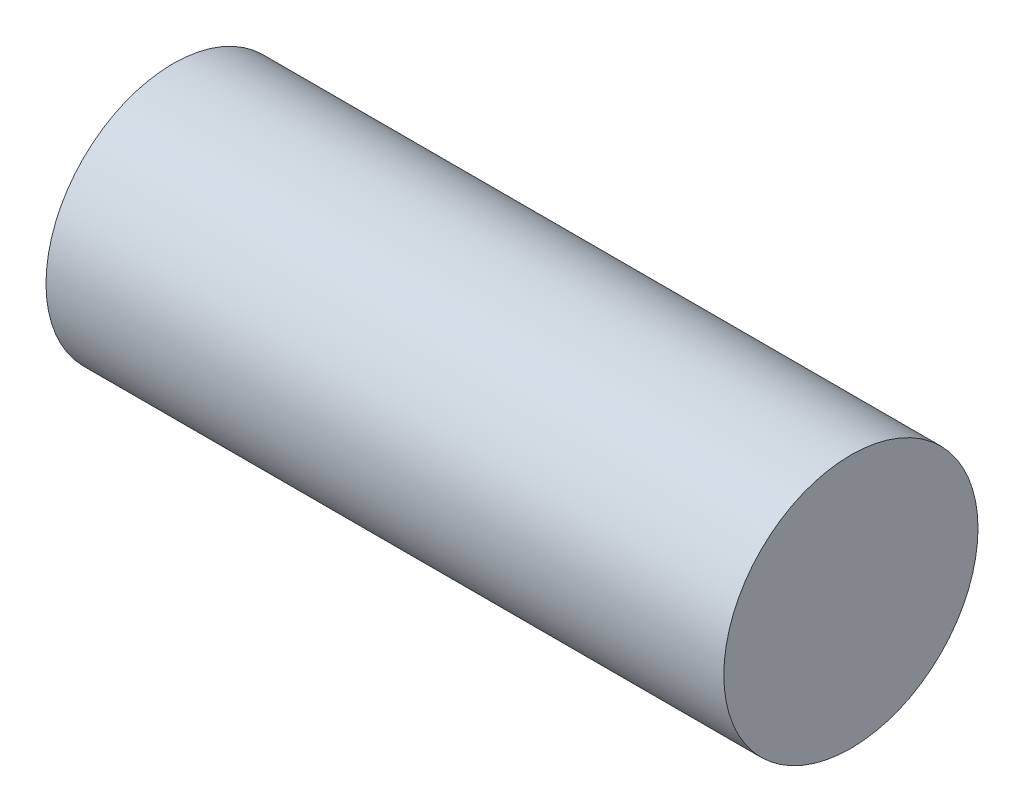
from build123d import *

# Parameters (mm, degrees)
SKETCH1_R           = 38.1
BOSS_EXTRUDE1_DEPTH = 101.6


with BuildPart() as part:
    # Sketch1 → Boss-Extrude1 (new, symmetric)
    with BuildSketch(Plane(origin=(0, 0, 0), x_dir=(0, 0, -1), z_dir=(1, 0, 0))):
        Circle(SKETCH1_R)
    extrude(amount=BOSS_EXTRUDE1_DEPTH, both=True)


solid = part.part
